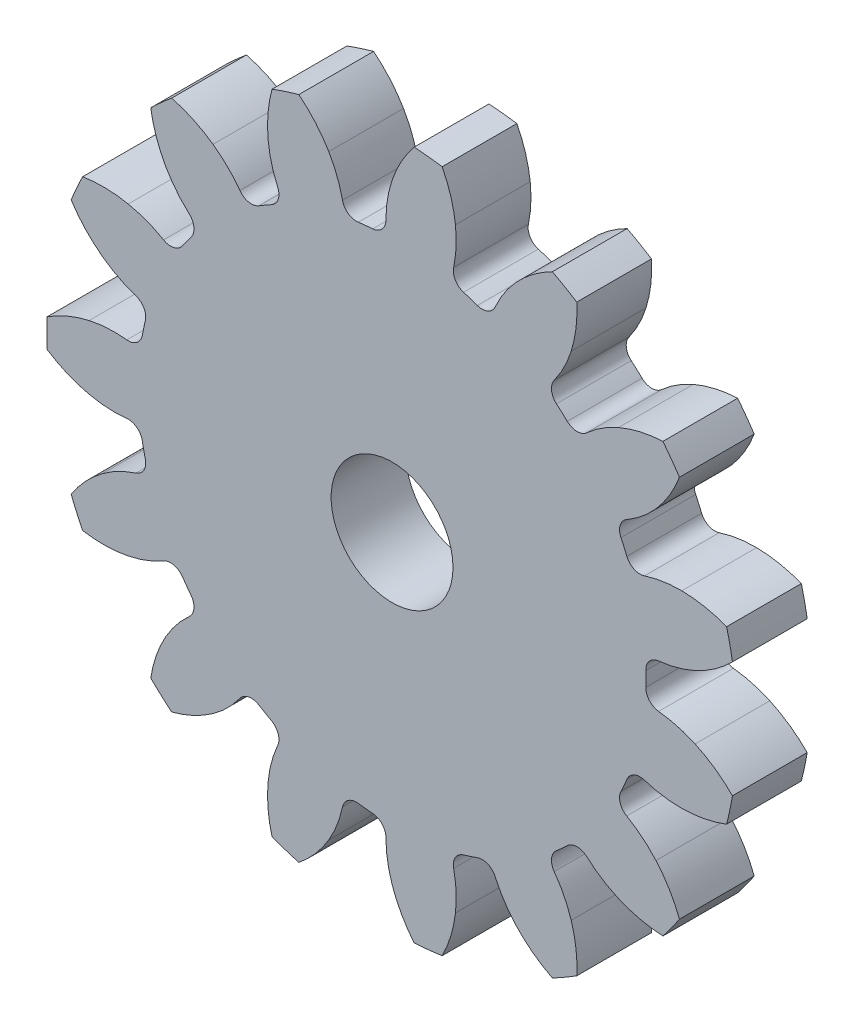
from build123d import *

# Parameters (mm, degrees)
SKETCH1_R        = 26.9875
GEAR_BASE_DEPTH  = 2.921
GEAR_CUT_DEPTH   = 39.610610931
GEAR_TEETH_COUNT = 15
SKETCH3_R        = 4.7625
BORE_DEPTH       = 39.572118529


with BuildPart() as part:
    # Sketch1 → GEAR_BASE (new, symmetric)
    with BuildSketch(Plane.XY):
        Circle(SKETCH1_R)
    extrude(amount=GEAR_BASE_DEPTH, both=True)

    # Sketch2 → GEAR_CUT (cut, through all)
    with BuildSketch(Plane.XY.offset(2.921)):
        with BuildLine():
            ThreePointArc((-25.081599898, -9.961852378), (-26.397758375, -5.611016756), (-26.965032052, -1.101000756))
            ThreePointArc((-26.965032052, -1.101000756), (-25.386045792, -1.945419828), (-23.681539378, -2.4939625))
            ThreePointArc((-23.681539378, -2.4939625), (-22.214193273, -2.699568669), (-20.732987425, -2.662049009))
            ThreePointArc((-20.732987425, -2.662049009), (-19.948924355, -2.876360551), (-19.520504813, -3.567114509))
            ThreePointArc((-19.520504813, -3.567114509), (-19.410116452, -4.125747615), (-19.283744683, -4.680983342))
            ThreePointArc((-19.283744683, -4.680983342), (-19.394170464, -5.486272409), (-20.023279363, -6.000962926))
            ThreePointArc((-20.023279363, -6.000962926), (-21.391688858, -6.569147705), (-22.648548664, -7.353801716))
            ThreePointArc((-22.648548664, -7.353801716), (-23.982580351, -8.5482056), (-25.081599898, -9.961852378))
        make_face()
    gear_cut = extrude(amount=-GEAR_CUT_DEPTH, mode=Mode.SUBTRACT)

    # GEAR_TEETH: GEAR_CUT ×15 about axis
    gear_teeth_axis = Axis((0, 0, 0), (0, 0, 1))
    for i in range(1, GEAR_TEETH_COUNT):
        add(gear_cut.rotate(gear_teeth_axis, i * 360 / GEAR_TEETH_COUNT), mode=Mode.SUBTRACT)

    # Sketch3 → BORE (cut, through all)
    with BuildSketch(Plane.XY.offset(2.921)):
        Circle(SKETCH3_R)
    extrude(amount=-BORE_DEPTH, mode=Mode.SUBTRACT)


solid = part.part
